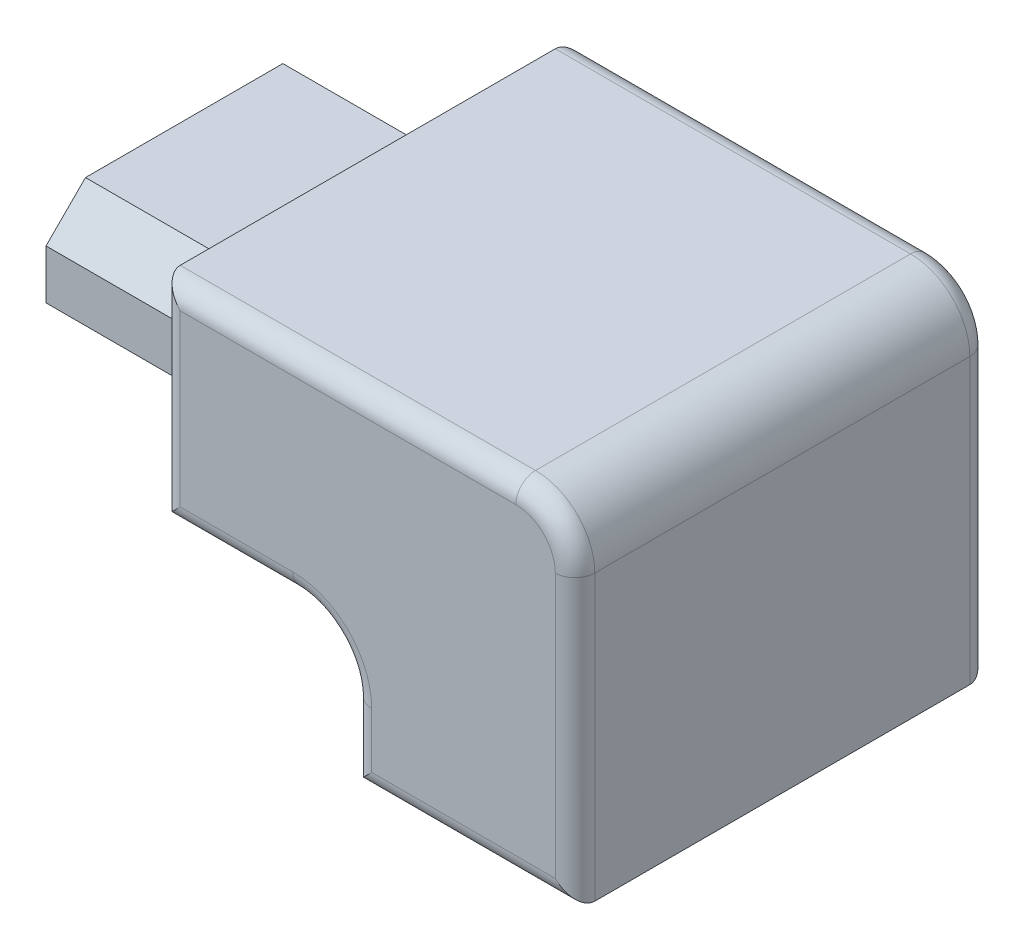
from build123d import *

# Parameters (mm, degrees)
EXTRUDE_1_DEPTH     = 21
EXTRUDE_2_DEPTH     = 9.3
CUT_EXTRUDE_1_DEPTH = 0.1
FILLET_1_R          = 3
FILLET_2_R          = 1


with BuildPart() as part:
    # 草图1 → 凸台-拉伸1 (new body)
    with BuildSketch(Plane.XY):
        Polygon((0, 17.4), (0, 0), (-11.3, 0), (-11.3, 6.8), (-21, 6.8), (-21, 17.4), align=None)
    extrude(amount=EXTRUDE_1_DEPTH)

    # 草图2 → 凸台-拉伸2 (add)
    with BuildSketch(Plane.ZY.offset(21)):
        Polygon((5.5, 14.35), (3.5, 12.35), (3.5, 9.85), (17.5, 9.85), (17.5, 12.35), (15.5, 14.35), align=None)
    extrude(amount=EXTRUDE_2_DEPTH)

    # 草图3 → 切除-拉伸1 (cut)
    with BuildSketch(Plane.XZ):
        Polygon((-7.9, 3.5), (-5.4, 3.5), (-3.4, 5.5), (-3.4, 15.5), (-5.4, 17.5), (-7.9, 17.5), align=None)
    extrude(amount=-CUT_EXTRUDE_1_DEPTH, mode=Mode.SUBTRACT)

    # 圆角1
    fillet_1_edges = [part.edges().sort_by_distance(p)[0] for p in [
        (0, 17.4, 10.5),
        (-11.3, 6.8, 10.5),
    ]]
    fillet(fillet_1_edges, radius=FILLET_1_R)

    # 圆角2
    fillet_2_edges = [part.edges().sort_by_distance(p)[0] for p in [
        (-5.65, 0, 21),
        (0, 7.2, 21),
        (-21, 12.1, 21),
        (-11.3, 1.9, 0),
        (-11.3, 1.9, 21),
        (-12, 17.4, 0),
        (-12, 17.4, 21),
        (-0.878679656, 16.521320344, 0),
        (-0.878679656, 16.521320344, 21),
        (-12.178679656, 5.921320344, 0),
        (-12.178679656, 5.921320344, 21),
        (0, 7.2, 0),
        (-5.65, 0, 0),
        (-17.65, 6.8, 21),
        (-17.65, 6.8, 0),
        (-21, 12.1, 0),
    ]]
    fillet(fillet_2_edges, radius=FILLET_2_R)


solid = part.part
